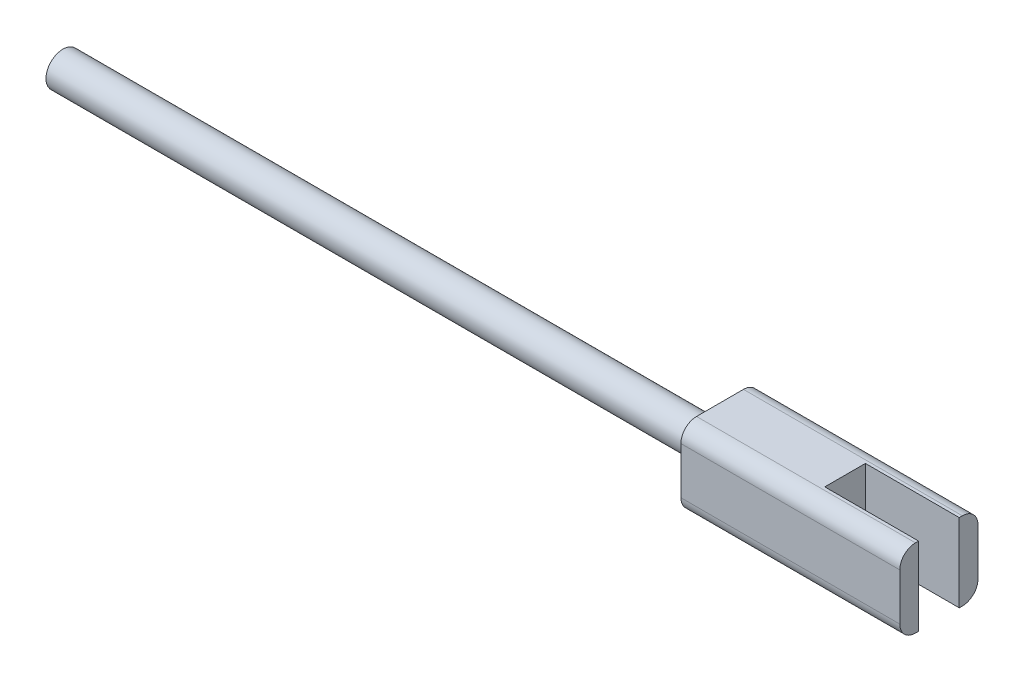
from build123d import *

# Parameters (mm, degrees)
SKETCH1_R               = 1.09
BOSS_EXTRUDE1_DEPTH     = 44.016
BOSS_EXTRUDE2_DEPTH     = 14
CUT_EXTRUDE1_DEPTH      = 57.127464365
CUT_EXTRUDE1_DEPTH_BACK = 57.127464365
SKETCH3_W               = 7
SKETCH3_H               = 2.6


with BuildPart() as part:
    # Sketch1 → Boss-Extrude1 (new body)
    with BuildSketch(Plane(origin=(0, 0, 0), x_dir=(0, 0, -1), z_dir=(1, 0, 0))):
        Circle(SKETCH1_R)
    extrude(amount=BOSS_EXTRUDE1_DEPTH)

    # Sketch2 → Boss-Extrude2 (add)
    with BuildSketch(Plane(origin=(42.016, 0, 0), x_dir=(0, 0, -1), z_dir=(1, 0, 0))):
        with BuildLine():
            Line((-1.5, -2.5), (1.5, -2.5))
            ThreePointArc((1.5, -2.5), (2.207106781, -2.207106781), (2.5, -1.5))
            Line((2.5, -1.5), (2.5, 1.5))
            ThreePointArc((2.5, 1.5), (2.207106781, 2.207106781), (1.5, 2.5))
            Line((1.5, 2.5), (-1.5, 2.5))
            ThreePointArc((-1.5, 2.5), (-2.207106781, 2.207106781), (-2.5, 1.5))
            Line((-2.5, 1.5), (-2.5, -1.5))
            ThreePointArc((-2.5, -1.5), (-2.207106781, -2.207106781), (-1.5, -2.5))
        make_face()
    extrude(amount=BOSS_EXTRUDE2_DEPTH)

    # Sketch3 → Cut-Extrude1 (cut, two sides: drawn at the far end of the back side and taken through both)
    with BuildSketch(Plane(origin=(0, 0, 0), x_dir=(1, 0, 0), z_dir=(0, 1, 0)).offset(-CUT_EXTRUDE1_DEPTH_BACK)):
        with Locations((53.516, 0)):
            Rectangle(SKETCH3_W, SKETCH3_H)
    extrude(amount=CUT_EXTRUDE1_DEPTH + CUT_EXTRUDE1_DEPTH_BACK, mode=Mode.SUBTRACT)


solid = part.part
